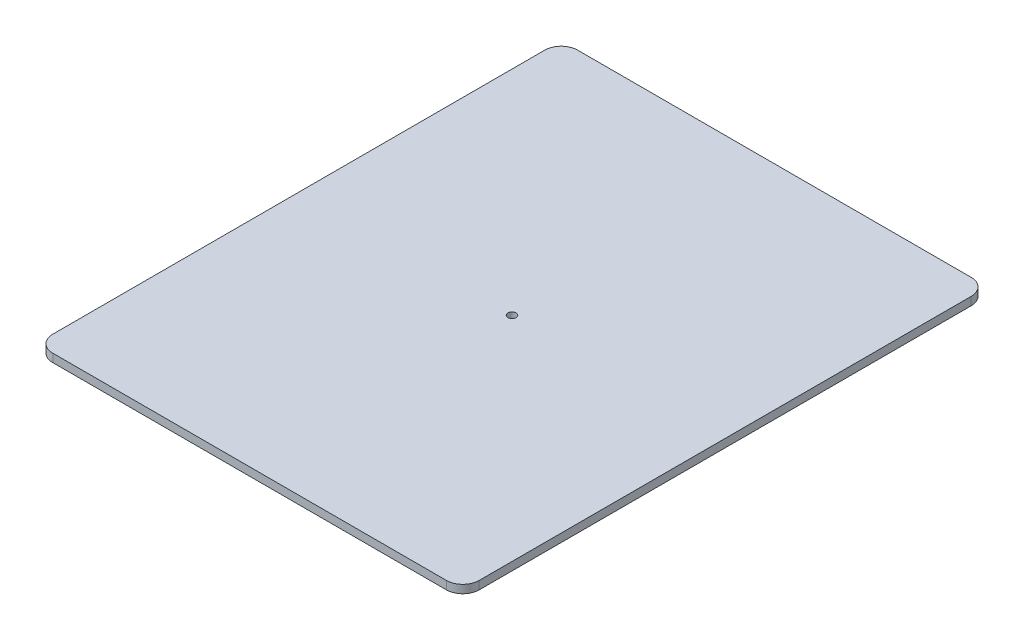
from build123d import *

# Parameters (mm, degrees)
SKETCH1_W           = 260
SKETCH1_H           = 320
BOSS_EXTRUDE1_DEPTH = 5
FILLET1_R           = 10
SKETCH2_R           = 2.5
CUT_EXTRUDE1_DEPTH  = 207.215906273


with BuildPart() as part:
    # Sketch1 → Boss-Extrude1 (new body)
    with BuildSketch(Plane(origin=(0, 0, 0), x_dir=(1, 0, 0), z_dir=(0, 1, 0))):
        Rectangle(SKETCH1_W, SKETCH1_H)
    extrude(amount=BOSS_EXTRUDE1_DEPTH)

    # Fillet1
    fillet1_edges = [part.edges().sort_by_distance(p)[0] for p in [
        (-130, 2.5, -160),
        (130, 2.5, -160),
        (130, 2.5, 160),
        (-130, 2.5, 160),
    ]]
    fillet(fillet1_edges, radius=FILLET1_R)

    # Sketch2 → Cut-Extrude1 (cut, through all)
    with BuildSketch(Plane(origin=(0, 5, 0), x_dir=(1, 0, 0), z_dir=(0, 1, 0))):
        with Locations(Location((0, 0, 0), (0, 0, 270))):
            Circle(SKETCH2_R)
    extrude(amount=-CUT_EXTRUDE1_DEPTH, mode=Mode.SUBTRACT)


solid = part.part
